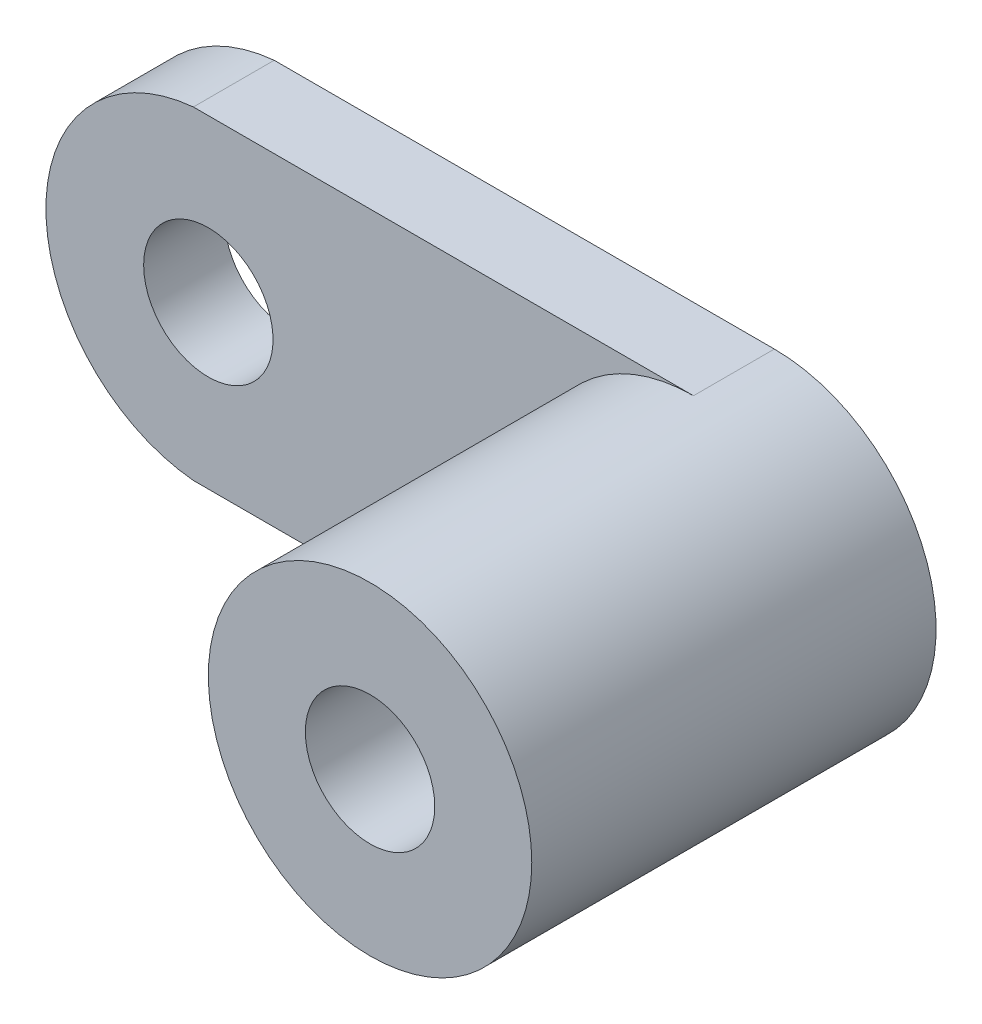
from build123d import *
from build123d.topology import SkipClean

# Parameters (mm, degrees)
SKETCH_1_R      = 4
SKETCH_1_R_2    = 1.6
EXTRUDE_1_DEPTH = 8
EXTRUDE_START   = 2
SKETCH_2_R      = 1.6
EXTRUDE_2_DEPTH = 2


with BuildPart() as part:
    # Эскиз1 → Бобышка-Вытянуть1 (new body)
    with BuildSketch(Plane.XY):
        Circle(SKETCH_1_R)
        Circle(SKETCH_1_R_2, mode=Mode.SUBTRACT)
    extrude(amount=EXTRUDE_1_DEPTH)

    # Эскиз2 → Бобышка-Вытянуть2 (add)
    with SkipClean():  # the faces are left unmerged after this step: merging them gives an invalid solid
        with BuildSketch(Plane(origin=(0, 0, 0), x_dir=(-1, 0, 0), z_dir=(0, 0, -1)).offset(EXTRUDE_START)):
            with BuildLine():
                Line((0, -4), (12.370366619, -4))
                ThreePointArc((12.370366619, -4), (16.017109836, 0), (12.370366619, 4))
                Line((12.370366619, 4), (0, 4))
                ThreePointArc((0, 4), (-4, 0), (0, -4))
            make_face()
            with Locations((12, 0)):
                Circle(SKETCH_2_R, mode=Mode.SUBTRACT)
            Circle(SKETCH_2_R, mode=Mode.SUBTRACT)
        extrude(amount=-EXTRUDE_2_DEPTH)


solid = part.part
